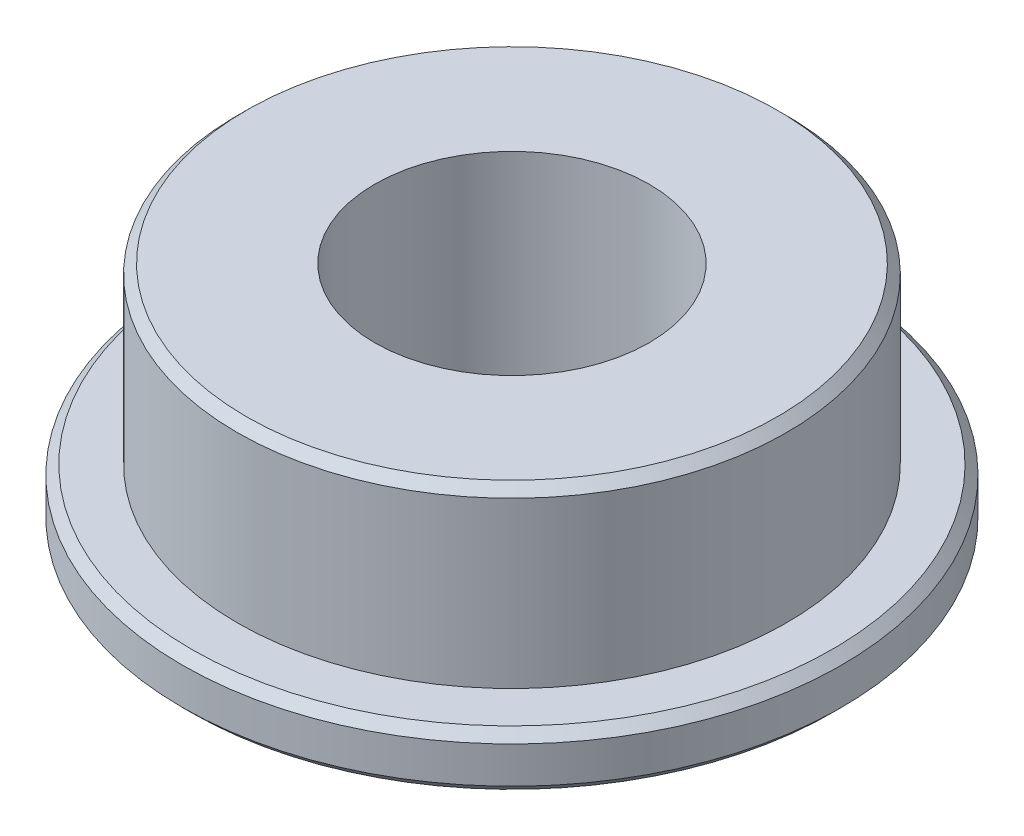
from build123d import *

# Parameters (mm, degrees)
SKETCH_1_R          = 3.6
SKETCH_1_R_2        = 1.5
EXTRUDE_1_DEPTH     = 2.5
CUT_EXTRUDE_START   = -1.9
SKETCH_2_R          = 3.6
SKETCH_2_R_2        = 3
CUT_EXTRUDE_1_DEPTH = 1.9
CHAMFER_1_SIZE      = 0.1


with BuildPart() as part:
    # 草图1 → 凸台-拉伸1 (new body)
    with BuildSketch(Plane(origin=(0, 0, 0), x_dir=(1, 0, 0), z_dir=(0, 1, 0))):
        with Locations(Location((0, 0, 0), (0, 0, 270))):
            Circle(SKETCH_1_R)
        with Locations(Location((0, 0, 0), (0, 0, 270))):
            Circle(SKETCH_1_R_2, mode=Mode.SUBTRACT)
    extrude(amount=EXTRUDE_1_DEPTH)

    # 草图2 → 切除-拉伸1 (cut)
    with BuildSketch(Plane(origin=(0, 2.5, 0), x_dir=(1, 0, 0), z_dir=(0, 1, 0)).offset(CUT_EXTRUDE_START)):
        with Locations(Location((0, 0, 0), (0, 0, 270))):
            Circle(SKETCH_2_R)
        with Locations(Location((0, 0, 0), (0, 0, 270))):
            Circle(SKETCH_2_R_2, mode=Mode.SUBTRACT)
    extrude(amount=CUT_EXTRUDE_1_DEPTH, mode=Mode.SUBTRACT)

    # 倒角1
    chamfer_1_edges = [part.edges().sort_by_distance(p)[0] for p in [
        (0, 0.6, -3.6),
        (0, 2.5, -3),
        (0, 0, -3.6),
    ]]
    chamfer(chamfer_1_edges, length=CHAMFER_1_SIZE)


solid = part.part
